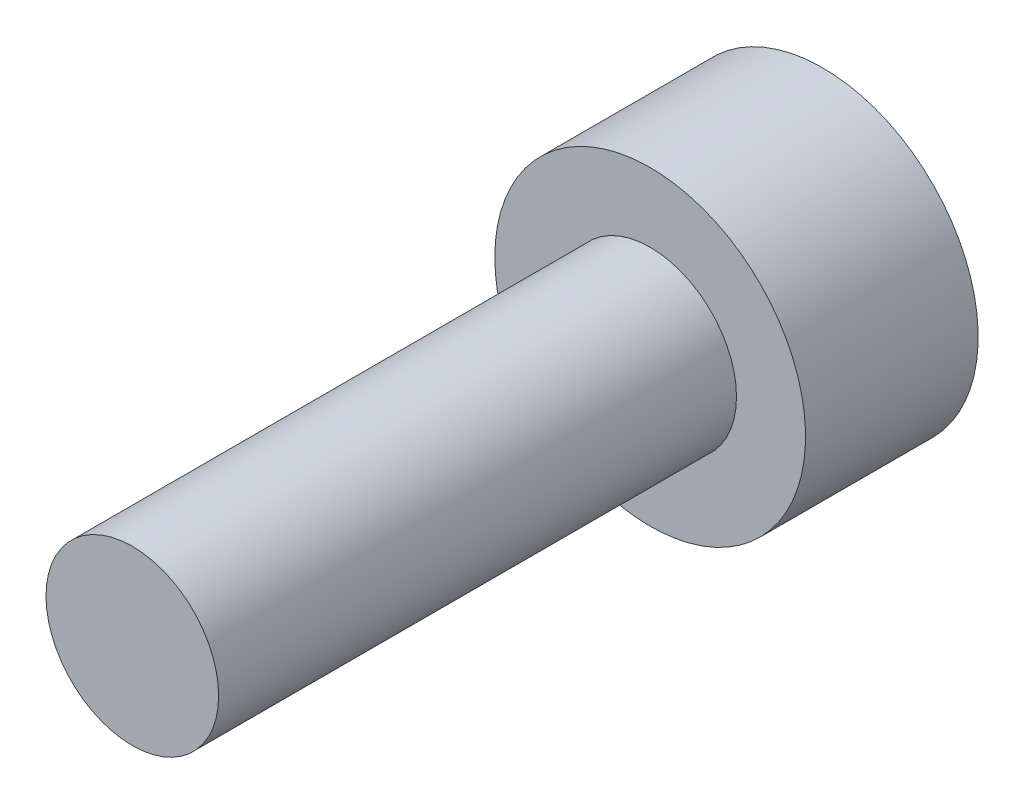
from build123d import *

# Parameters (mm, degrees)
SKETCH_1_R          = 2.5
EXTRUDE_1_DEPTH     = 15
SKETCH_2_R          = 4.5
EXTRUDE_2_DEPTH     = 5
CUT_EXTRUDE_1_DEPTH = 2.9


with BuildPart() as part:
    # 草图1 → 凸台-拉伸1 (new body)
    with BuildSketch(Plane.XY):
        Circle(SKETCH_1_R)
    extrude(amount=EXTRUDE_1_DEPTH)

    # 草图2 → 凸台-拉伸2 (add)
    with BuildSketch(Plane(origin=(0, 0, 0), x_dir=(-1, 0, 0), z_dir=(0, 0, -1))):
        Circle(SKETCH_2_R)
    extrude(amount=EXTRUDE_2_DEPTH)

    # 草图3 → 切除-拉伸1 (cut)
    with BuildSketch(Plane(origin=(0, 0, -5), x_dir=(-1, 0, 0), z_dir=(0, 0, -1))):
        Polygon((0, 2.886751346), (-2.5, 1.443375673), (-2.5, -1.443375673), (0, -2.886751346), (2.5, -1.443375673), (2.5, 1.443375673), align=None)
    extrude(amount=-CUT_EXTRUDE_1_DEPTH, mode=Mode.SUBTRACT)


solid = part.part
